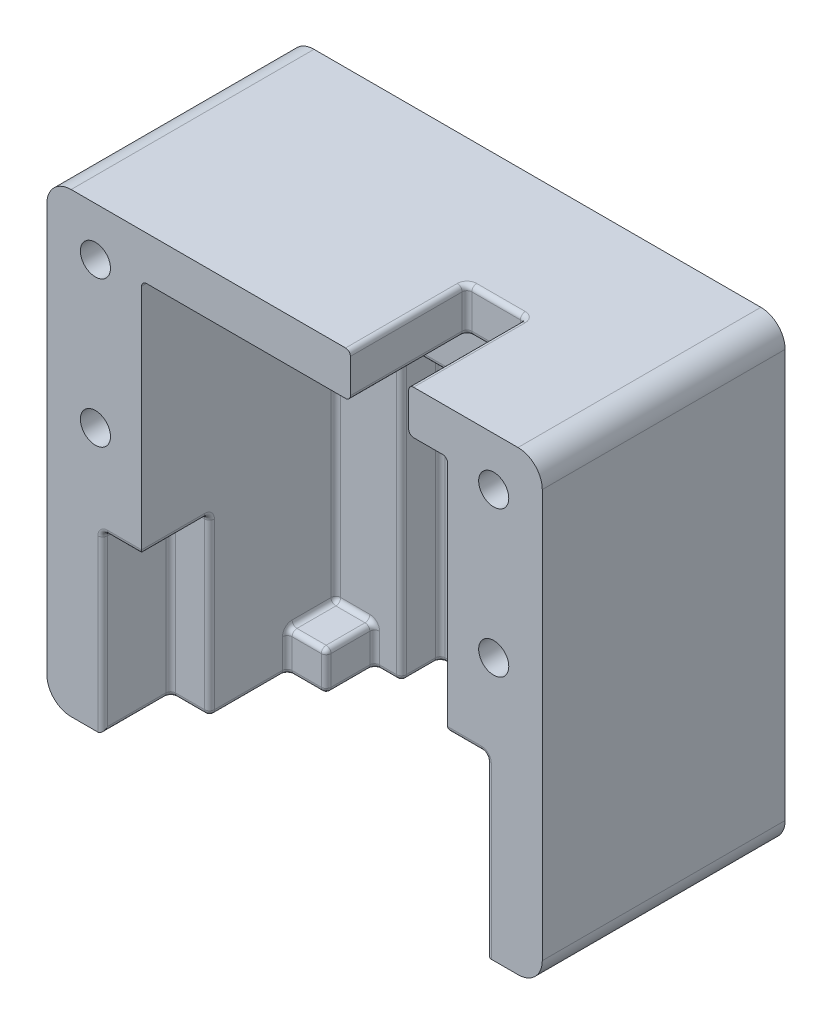
from build123d import *

# Parameters (mm, degrees)
SKETCH1_W           = 51
SKETCH1_H           = 47
BOSS_EXTRUDE1_DEPTH = 5
BOSS_EXTRUDE2_DEPTH = 20
SKETCH4_W           = 4
SKETCH4_H           = 4
BOSS_EXTRUDE3_DEPTH = 5
SKETCH5_W           = 4
SKETCH5_H           = 18
CUT_EXTRUDE1_DEPTH  = 7
SKETCH7_W           = 6
SKETCH7_H           = 4.5
CUT_EXTRUDE2_DEPTH  = 12
CUT_EXTRUDE3_DEPTH  = 4
SKETCH9_R           = 1.55
CUT_EXTRUDE4_DEPTH  = 10
SKETCH10_R          = 1.75
CUT_EXTRUDE5_DEPTH  = 73.18032973
SKETCH11_R          = 2.5
CUT_EXTRUDE6_DEPTH  = 2
FILLET1_R           = 0.5
FILLET2_R           = 2.5


with BuildPart() as part:
    # Sketch1 → Boss-Extrude1 (new body)
    with BuildSketch(Plane.XY):
        with Locations((25.5, 23.5)):
            Rectangle(SKETCH1_W, SKETCH1_H)
    extrude(amount=BOSS_EXTRUDE1_DEPTH)

    # Sketch2 → Boss-Extrude2 (add)
    with BuildSketch(Plane.XY.offset(5)):
        Polygon((0, 0), (0, 47), (51, 47), (51, 0), (41.25, 0), (41.25, 42.5), (9.75, 42.5), (9.75, 0), align=None)
    extrude(amount=BOSS_EXTRUDE2_DEPTH)

    # Sketch4 → Boss-Extrude3 (add)
    with BuildSketch(Plane.XY.offset(5)):
        with Locations((39.25, 2)):
            Rectangle(SKETCH4_W, SKETCH4_H)
        with Locations((11.75, 2)):
            Rectangle(SKETCH4_W, SKETCH4_H)
    extrude(amount=BOSS_EXTRUDE3_DEPTH)

    # Sketch5 → Cut-Extrude1 (cut)
    with BuildSketch(Plane.XY.offset(25)):
        with Locations((43.25, 9)):
            Rectangle(SKETCH5_W, SKETCH5_H)
        with Locations((7.75, 9)):
            Rectangle(SKETCH5_W, SKETCH5_H)
    extrude(amount=-CUT_EXTRUDE1_DEPTH, mode=Mode.SUBTRACT)

    # Sketch7 → Cut-Extrude2 (cut)
    with BuildSketch(Plane.XY.offset(25)):
        with Locations((34.25, 44.75)):
            Rectangle(SKETCH7_W, SKETCH7_H)
    extrude(amount=-CUT_EXTRUDE2_DEPTH, mode=Mode.SUBTRACT)

    # Sketch8 → Cut-Extrude3 (cut)
    with BuildSketch(Plane.XY.offset(5)):
        Polygon((25.5, 0), (34.5, 0), (34.5, 30), (16.5, 30), (16.5, 0), align=None)
    extrude(amount=-CUT_EXTRUDE3_DEPTH, mode=Mode.SUBTRACT)

    # Sketch9 → Cut-Extrude4 (cut)
    with BuildSketch(Plane.XY.offset(25)):
        with Locations((5, 27)):
            Circle(SKETCH9_R)
        with Locations((5, 42)):
            Circle(SKETCH9_R)
        with Locations((46, 42)):
            Circle(SKETCH9_R)
        with Locations((46, 27)):
            Circle(SKETCH9_R)
    extrude(amount=-CUT_EXTRUDE4_DEPTH, mode=Mode.SUBTRACT)

    # Sketch10 → Cut-Extrude5 (cut, through all)
    with BuildSketch(Plane.XY.offset(5)):
        with Locations((17.5, 34.5)):
            Circle(SKETCH10_R)
        with Locations((33.5, 34.5)):
            Circle(SKETCH10_R)
    extrude(amount=-CUT_EXTRUDE5_DEPTH, mode=Mode.SUBTRACT)

    # Sketch11 → Cut-Extrude6 (cut)
    with BuildSketch(Plane.XY.offset(5)):
        with Locations((17.5, 34.5)):
            Circle(SKETCH11_R)
        with Locations((33.5, 34.5)):
            Circle(SKETCH11_R)
    extrude(amount=-CUT_EXTRUDE6_DEPTH, mode=Mode.SUBTRACT)

    # Fillet1
    fillet1_edges = [part.edges().sort_by_distance(p)[0] for p in [
        (35.875, 0, 5),
        (16.5, 15, 1),
        (16.5, 0, 3),
        (25.5, 30, 1),
        (34.5, 15, 1),
        (25.5, 0, 1),
        (34.5, 0, 3),
        (16.5, 15, 5),
        (34.5, 15, 5),
        (25.5, 30, 5),
        (25.5, 42.5, 5),
        (9.75, 42.5, 15),
        (41.25, 23.25, 5),
        (41.25, 42.5, 15),
        (39.25, 4, 5),
        (41.25, 4, 7.5),
        (37.25, 2, 5),
        (37.25, 4, 7.5),
        (37.25, 0, 7.5),
        (41.25, 2, 10),
        (39.25, 4, 10),
        (37.25, 2, 10),
        (39.25, 0, 10),
        (9.75, 23.25, 5),
        (15.125, 0, 5),
        (9.75, 4, 7.5),
        (13.75, 2, 5),
        (13.75, 0, 7.5),
        (11.75, 4, 5),
        (13.75, 4, 7.5),
        (9.75, 2, 10),
        (11.75, 0, 10),
        (13.75, 2, 10),
        (11.75, 4, 10),
        (9.75, 0, 14),
        (41.25, 0, 14),
        (43.25, 0, 18),
        (45.25, 0, 21.5),
        (41.25, 9, 18),
        (43.25, 18, 18),
        (41.25, 18, 21.5),
        (45.25, 9, 18),
        (45.25, 18, 21.5),
        (45.25, 9, 25),
        (43.25, 18, 25),
        (7.75, 0, 18),
        (5.75, 9, 18),
        (5.75, 0, 21.5),
        (7.75, 18, 18),
        (5.75, 18, 21.5),
        (9.75, 9, 18),
        (9.75, 18, 21.5),
        (7.75, 18, 25),
        (5.75, 9, 25),
        (34.25, 47, 13),
        (31.25, 47, 19),
        (37.25, 44.75, 13),
        (37.25, 47, 19),
        (34.25, 42.5, 13),
        (37.25, 42.5, 19),
        (31.25, 44.75, 13),
        (31.25, 42.5, 19),
    ]]
    fillet(fillet1_edges, radius=FILLET1_R)

    # Fillet2
    fillet2_edges = [part.edges().sort_by_distance(p)[0] for p in [
        (0, 47, 12.5),
        (51, 47, 12.5),
        (51, 0, 12.5),
        (0, 0, 12.5),
    ]]
    fillet(fillet2_edges, radius=FILLET2_R)


solid = part.part
